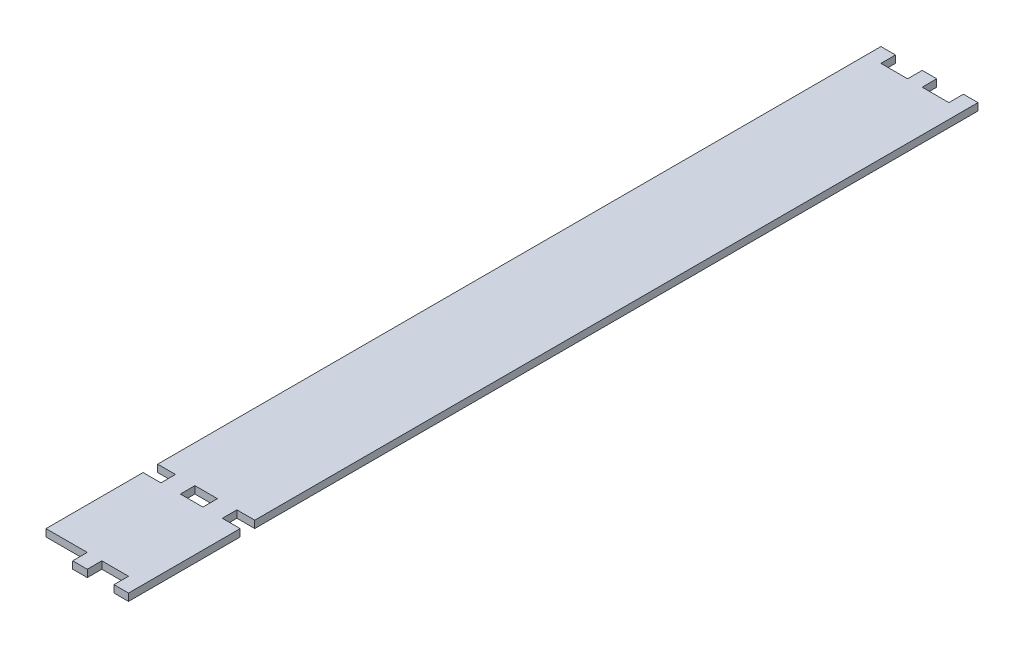
from build123d import *

# Parameters (mm, degrees)
ESQUISSE1_W             = 40
ESQUISSE1_H             = 3
BOSS_EXTRU_1_DEPTH      = 338
ESQUISSE2_W             = 7.35
ESQUISSE2_H             = 6
ESQUISSE2_W_2           = 9.3
ENL_V_MAT_EXTRU_1_DEPTH = 6
ESQUISSE3_W             = 6
ESQUISSE3_H             = 3
BOSS_EXTRU_2_DEPTH      = 6
ESQUISSE4_W             = 6
ESQUISSE4_H             = 6
ENL_V_MAT_EXTRU_2_DEPTH = 6


with BuildPart() as part:
    # Esquisse1 → Boss.-Extru.1 (new body)
    with BuildSketch(Plane.XY):
        with Locations((20, 1.5)):
            Rectangle(ESQUISSE1_W, ESQUISSE1_H)
    extrude(amount=BOSS_EXTRU_1_DEPTH)

    # Esquisse2 → Enlèv. mat.-Extru.1 (cut)
    with BuildSketch(Plane(origin=(0, 3, 0), x_dir=(1, 0, 0), z_dir=(0, 1, 0))):
        with Locations((3.675, -295)):
            Rectangle(ESQUISSE2_W, ESQUISSE2_H)
        with Locations((20, -295)):
            Rectangle(ESQUISSE2_W_2, ESQUISSE2_H)
        with Locations((36.325, -295)):
            Rectangle(ESQUISSE2_W, ESQUISSE2_H)
    extrude(amount=-ENL_V_MAT_EXTRU_1_DEPTH, mode=Mode.SUBTRACT)

    # Esquisse3 → Boss.-Extru.2 (add)
    with BuildSketch(Plane.XY.offset(338)):
        with Locations((3, 1.5)):
            Rectangle(ESQUISSE3_W, ESQUISSE3_H)
        with Locations((20, 1.5)):
            Rectangle(ESQUISSE3_W, ESQUISSE3_H)
        with Locations((37, 1.5)):
            Rectangle(ESQUISSE3_W, ESQUISSE3_H)
    boss_extru_2 = extrude(amount=BOSS_EXTRU_2_DEPTH)

    # Symétrie1: Boss.-Extru.2 across plane
    add(boss_extru_2.mirror(Plane.XY.offset(169)))

    # Esquisse4 → Enlèv. mat.-Extru.2 (cut)
    with BuildSketch(Plane.XZ):
        with Locations((3, 341)):
            Rectangle(ESQUISSE4_W, ESQUISSE4_H)
    extrude(amount=-ENL_V_MAT_EXTRU_2_DEPTH, mode=Mode.SUBTRACT)


solid = part.part
